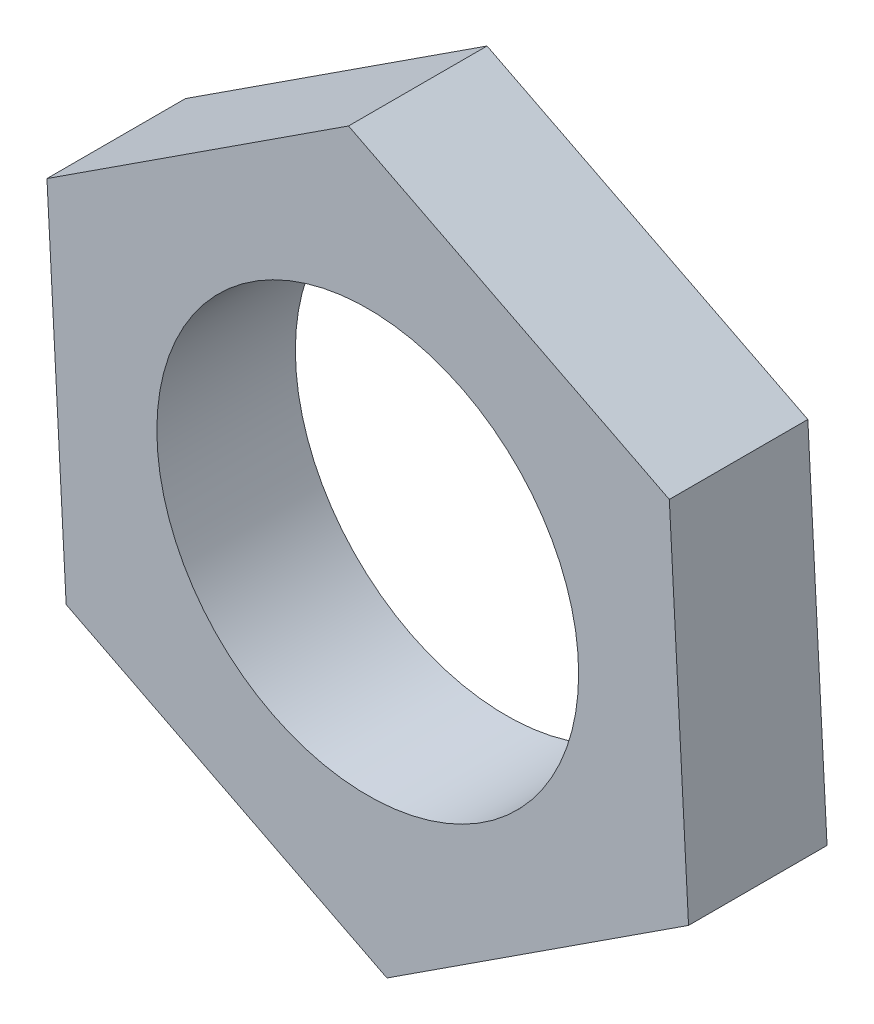
from build123d import *

# Parameters (mm, degrees)
SKETCH_1_R      = 3.35
EXTRUDE_2_DEPTH = 2.2


with BuildPart() as part:
    # 草图1 → 凸台-拉伸2 (new body)
    with BuildSketch(Plane.XY):
        Polygon((0.305310367, -5.707607693), (5.095588441, -2.589397313), (4.790278074, 3.11821038), (-0.305310367, 5.707607693), (-5.095588441, 2.589397313), (-4.790278074, -3.11821038), align=None)
        Circle(SKETCH_1_R, mode=Mode.SUBTRACT)
    extrude(amount=EXTRUDE_2_DEPTH)


solid = part.part
